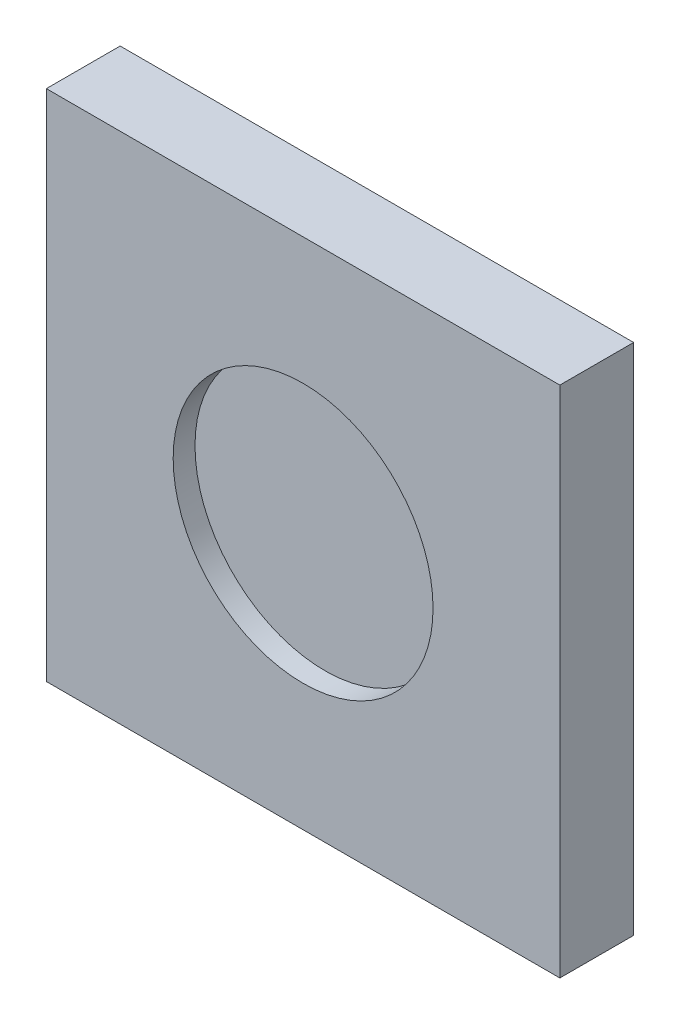
from build123d import *

# Parameters (mm, degrees)
SKETCH1_W           = 49.4
SKETCH1_H           = 49.4
SKETCH1_R           = 12.5
BOSS_EXTRUDE1_DEPTH = 7.1
SKETCH5_R           = 12.5
BOSS_EXTRUDE2_DEPTH = 5


with BuildPart() as part:
    # Sketch1 → Boss-Extrude1 (new body)
    with BuildSketch(Plane.XY):
        with Locations((24.7, 24.7)):
            Rectangle(SKETCH1_W, SKETCH1_H)
        with Locations((24.7, 24.7)):
            Circle(SKETCH1_R, mode=Mode.SUBTRACT)
    extrude(amount=BOSS_EXTRUDE1_DEPTH)

    # Sketch5 → Boss-Extrude2 (add)
    with BuildSketch(Plane(origin=(0, 0, 0), x_dir=(-1, 0, 0), z_dir=(0, 0, -1))):
        with Locations((-24.7, 24.7)):
            Circle(SKETCH5_R)
    extrude(amount=-BOSS_EXTRUDE2_DEPTH)


solid = part.part
